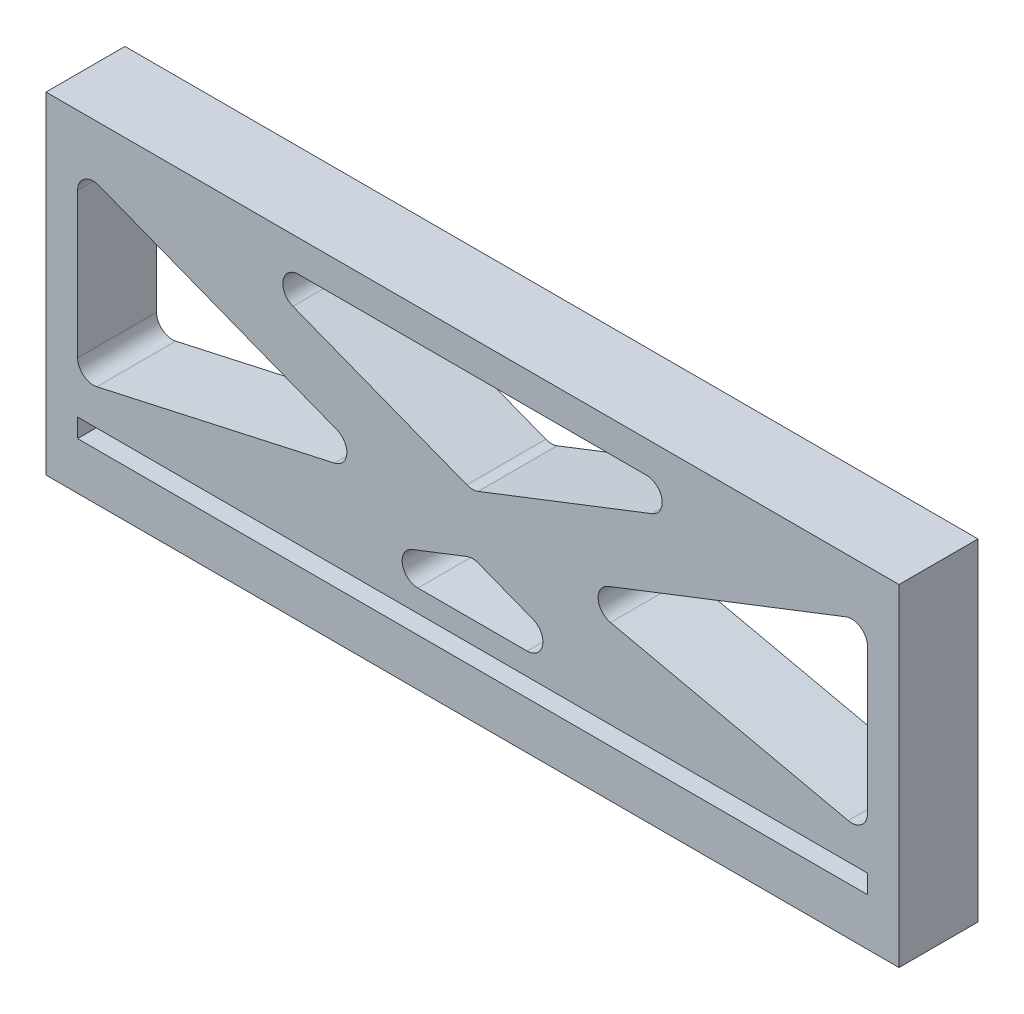
from build123d import *

# Parameters (mm, degrees)
SKETCH1_W           = 68.58
SKETCH1_H           = 26.67
SKETCH1_W_2         = 63.5
SKETCH1_H_2         = 1.5
BOSS_EXTRUDE1_DEPTH = 6.35
FILLET1_R           = 1.27


with BuildPart() as part:
    # Sketch1 → Boss-Extrude1 (new body)
    with BuildSketch(Plane.XY):
        Rectangle(SKETCH1_W, SKETCH1_H)
        Polygon((-20.750635985, 10.795), (0, 2.725308228), (20.750635985, 10.795), align=None, mode=Mode.SUBTRACT)
        with Locations((0, -8.775)):
            Rectangle(SKETCH1_W_2, SKETCH1_H_2, mode=Mode.SUBTRACT)
        Polygon((-31.75, 9.621913994), (-31.75, -5.485), (-7.007935444, 0), align=None, mode=Mode.SUBTRACT)
        Polygon((7.007935444, 0), (31.75, 9.621913994), (31.75, -5.485), align=None, mode=Mode.SUBTRACT)
        Polygon((0, -1.90771576), (-11.158159475, -6.247), (11.158159475, -6.247), align=None, mode=Mode.SUBTRACT)
    extrude(amount=BOSS_EXTRUDE1_DEPTH)

    # Fillet1
    fillet1_edges = [part.edges().sort_by_distance(p)[0] for p in [
        (20.750635985, 10.795, 3.175),
        (-20.750635985, 10.795, 3.175),
        (0, 2.725308228, 3.175),
        (-7.007935444, 0, 3.175),
        (-31.75, 9.621913994, 3.175),
        (-31.75, -5.485, 3.175),
        (7.007935444, 0, 3.175),
        (31.75, -5.485, 3.175),
        (31.75, 9.621913994, 3.175),
        (11.158159475, -6.247, 3.175),
        (0, -1.90771576, 3.175),
        (-11.158159475, -6.247, 3.175),
    ]]
    fillet(fillet1_edges, radius=FILLET1_R)


solid = part.part
